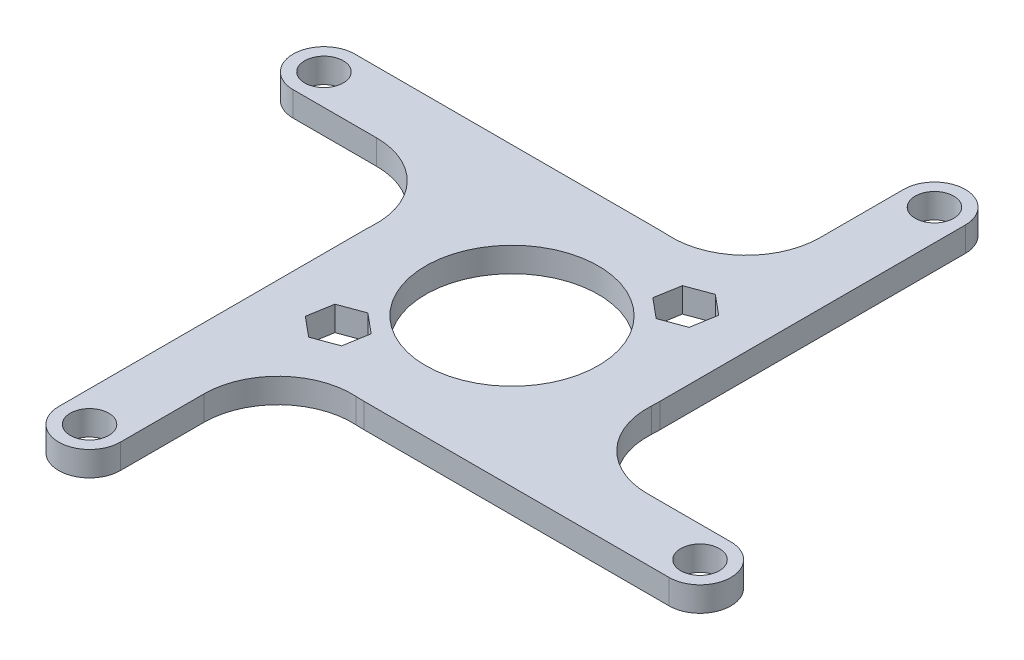
from build123d import *

# Parameters (mm, degrees)
SKETCH1_R           = 14
SKETCH1_R_2         = 3.125
BOSS_EXTRUDE1_DEPTH = 4
FILLET1_R           = 12
CUT_EXTRUDE2_DEPTH  = 10


with BuildPart() as part:
    # Sketch1 → Boss-Extrude1 (new body)
    with BuildSketch(Plane(origin=(0, 0, 0), x_dir=(1, 0, 0), z_dir=(0, 1, 0))):
        with BuildLine():
            Line((-49.477267507, 24), (0, 24))
            ThreePointArc((0, 24), (7.353702178, 22.845635563), (14, 19.49358869))
            Line((14, 19.49358869), (14, 49.477267507))
            ThreePointArc((14, 49.477267507), (19, 54.477267507), (24, 49.477267507))
            Line((24, 49.477267507), (24, 0))
            ThreePointArc((24, 0), (22.845635563, -7.353702178), (19.49358869, -14))
            Line((19.49358869, -14), (49.477267507, -14))
            ThreePointArc((49.477267507, -14), (54.477267507, -19), (49.477267507, -24))
            Line((49.477267507, -24), (0, -24))
            ThreePointArc((0, -24), (-7.353702178, -22.845635563), (-14, -19.49358869))
            Line((-14, -19.49358869), (-14, -49.477267507))
            ThreePointArc((-14, -49.477267507), (-19, -54.477267507), (-24, -49.477267507))
            Line((-24, -49.477267507), (-24, 0))
            ThreePointArc((-24, 0), (-22.845635563, 7.353702178), (-19.49358869, 14))
            Line((-19.49358869, 14), (-49.477267507, 14))
            ThreePointArc((-49.477267507, 14), (-54.477267507, 19), (-49.477267507, 24))
        make_face()
        with Locations(Location((0, 0, 0), (0, 0, 270))):
            Circle(SKETCH1_R, mode=Mode.SUBTRACT)
        with Locations(Location((-19, -49.477267507, 0), (0, 0, 270))):
            Circle(SKETCH1_R_2, mode=Mode.SUBTRACT)
        with Locations(Location((-49.477267507, 19, 0), (0, 0, 270))):
            Circle(SKETCH1_R_2, mode=Mode.SUBTRACT)
        with Locations(Location((19, 49.477267507, 0), (0, 0, 270))):
            Circle(SKETCH1_R_2, mode=Mode.SUBTRACT)
        with Locations(Location((49.477267507, -19, 0), (0, 0, 270))):
            Circle(SKETCH1_R_2, mode=Mode.SUBTRACT)
    extrude(amount=BOSS_EXTRUDE1_DEPTH)

    # Fillet1
    fillet1_edges = [part.edges().sort_by_distance(p)[0] for p in [
        (-19.49358869, 2, -14),
        (14, 2, -19.49358869),
        (19.49358869, 2, 14),
        (-14, 2, 19.49358869),
    ]]
    fillet(fillet1_edges, radius=FILLET1_R)

    # Sketch3 → Cut-Extrude2 (cut)
    with BuildSketch(Plane(origin=(0, 4, 0), x_dir=(1, 0, 0), z_dir=(0, 1, 0))):
        Polygon((9.585169941, 18.038972177), (8.882922363, 13.941796523), (12.080056774, 11.285044454), (15.979438763, 12.725468039), (16.681686341, 16.822643693), (13.48455193, 19.479395762), align=None)
        Polygon((-15.979438763, -12.725468039), (-16.681686341, -16.822643693), (-13.48455193, -19.479395762), (-9.585169941, -18.038972177), (-8.882922363, -13.941796523), (-12.080056774, -11.285044454), align=None)
    extrude(amount=-CUT_EXTRUDE2_DEPTH, mode=Mode.SUBTRACT)


solid = part.part
